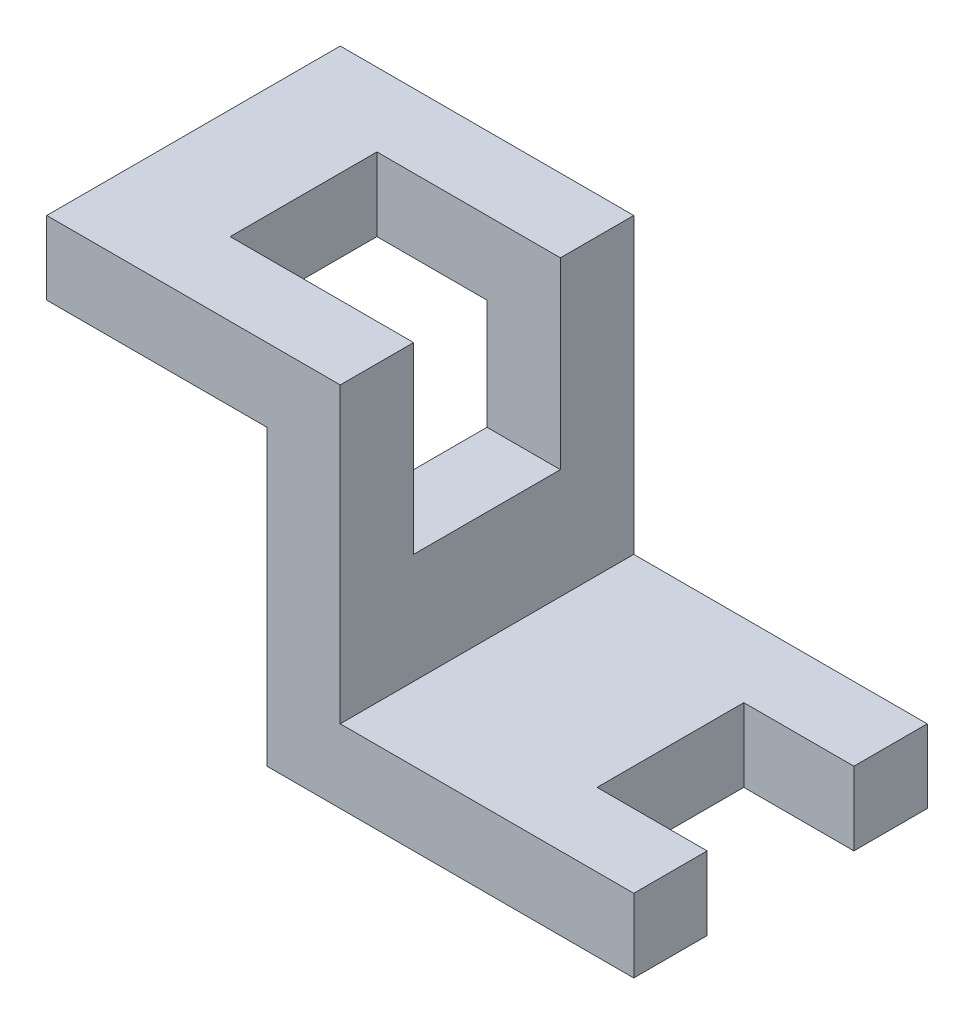
from build123d import *

# Parameters (mm, degrees)
BOSS_EXTRUDE1_DEPTH = 40
SKETCH2_W           = 15
SKETCH2_H           = 20
CUT_EXTRUDE1_DEPTH  = 40
SKETCH3_W           = 15
SKETCH3_H           = 20
SKETCH3_W_2         = 10
CUT_EXTRUDE2_DEPTH  = 25


with BuildPart() as part:
    # Sketch1 → Boss-Extrude1 (new body)
    with BuildSketch(Plane.XY):
        Polygon((-50.793103448, 82.275862069), (-10.793103448, 82.275862069), (-10.793103448, 42.275862069), (29.206896552, 42.275862069), (29.206896552, 32.275862069), (-20.793103448, 32.275862069), (-20.793103448, 72.275862069), (-50.793103448, 72.275862069), align=None)
    extrude(amount=BOSS_EXTRUDE1_DEPTH)

    # Sketch2 → Cut-Extrude1 (cut)
    with BuildSketch(Plane(origin=(0, 42.275862069, 0), x_dir=(1, 0, 0), z_dir=(0, 1, 0))):
        with Locations((21.706896552, -20)):
            Rectangle(SKETCH2_W, SKETCH2_H)
    extrude(amount=-CUT_EXTRUDE1_DEPTH, mode=Mode.SUBTRACT)

    # Sketch3 → Cut-Extrude2 (cut)
    with BuildSketch(Plane(origin=(0, 82.275862069, 0), x_dir=(1, 0, 0), z_dir=(0, 1, 0))):
        with Locations((-28.293103448, -20)):
            Rectangle(SKETCH3_W, SKETCH3_H)
        with Locations((-15.793103448, -20)):
            Rectangle(SKETCH3_W_2, SKETCH3_H)
    extrude(amount=-CUT_EXTRUDE2_DEPTH, mode=Mode.SUBTRACT)


solid = part.part
